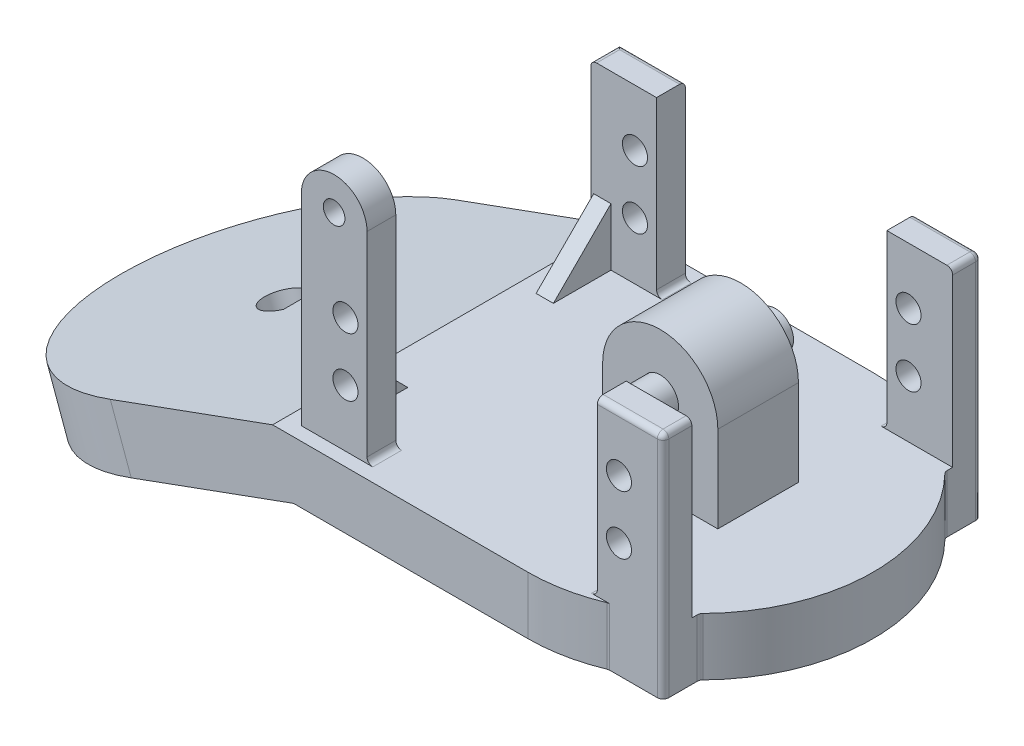
from build123d import *

# Parameters (mm, degrees)
BOSS_EXTRU_3_DEPTH       = 5
ESQUISSE7_R              = 3.175
BOSS_EXTRU_5_DEPTH       = 7
ESQUISSE13_R             = 2.18
BOSS_EXTRU_8_DEPTH       = 5
ENL_V_MAT_EXTRU_8_REACH  = 100.981
ESQUISSE47_W             = 40
ESQUISSE47_H             = 5
ESQUISSE33_W             = 9.466792894
ESQUISSE33_H             = 55.28
BOSS_EXTRU_10_DEPTH      = 10
ENL_V_MAT_EXTRU_6_DEPTH  = 65
ESQUISSE35_R             = 30
BOSS_EXTRU_11_DEPTH      = 5.32
BOSS_EXTRU_12_DEPTH      = 30
ENL_V_MAT_EXTRU_7_DEPTH  = 60
BOSS_EXTRU_13_DEPTH      = 5
NERVURE4_REACH           = 90.538
ESQUISSE45_WALL_W        = 193.218913386
ESQUISSE45_WALL_H        = 3
CONG_1_R                 = 1
CONG_2_R                 = 1
BOSS_EXTRU_14_DEPTH      = 13
BOSS_EXTRU_14_DEPTH_BACK = 13
ESQUISSE48_R             = 3.15


with BuildPart() as part:
    # Esquisse5 → Boss.-Extru.3 (new, symmetric)
    with BuildSketch(Plane(origin=(0, 0, 0), x_dir=(1, 0, 0), z_dir=(0, 1, 0))):
        with BuildLine():
            Line((42.5, -30), (-42.5, -30))
            ThreePointArc((-42.5, -30), (-72.5, 0), (-42.5, 30))
            Line((-42.5, 30), (42.5, 30))
            ThreePointArc((42.5, 30), (72.5, 0), (42.5, -30))
        make_face()
    extrude(amount=BOSS_EXTRU_3_DEPTH, both=True)

    # Esquisse7 → Boss.-Extru.5 (add, symmetric)
    with BuildSketch(Plane.XY):
        with BuildLine():
            Line((32.5, 5), (52.5, 5))
            Line((52.5, 5), (52.5, 20))
            ThreePointArc((52.5, 20), (42.5, 30), (32.5, 20))
            Line((32.5, 20), (32.5, 5))
        make_face()
        with Locations((42.5, 20)):
            Circle(ESQUISSE7_R, mode=Mode.SUBTRACT)
    extrude(amount=BOSS_EXTRU_5_DEPTH, both=True)

    # Esquisse13 → Boss.-Extru.8 (add)
    with BuildSketch(Plane.XY.offset(22.64)):
        Polygon((0.8, 5), (5.8, 5), (12.215, 5), (12.215, 29.91), (52.215, 29.91), (52.215, 5), (58.63, 5), (63.63, 5), (63.63, 34.91), (0.8, 34.91), align=None)
        with Locations((8.47, 14.92)):
            Circle(ESQUISSE13_R, mode=Mode.SUBTRACT)
        with Locations((55.97, 14.92)):
            Circle(ESQUISSE13_R, mode=Mode.SUBTRACT)
        with Locations((8.47, 25.08)):
            Circle(ESQUISSE13_R, mode=Mode.SUBTRACT)
        with Locations((55.97, 25.08)):
            Circle(ESQUISSE13_R, mode=Mode.SUBTRACT)
    boss_extru_8 = extrude(amount=BOSS_EXTRU_8_DEPTH)

    # Esquisse47 → Enlèv. mat.-Extru.8 (cut, up to next)
    with BuildSketch(Plane.XY.offset(27.64), mode=Mode.PRIVATE) as enl_v_mat_extru_8_sk1:
        with Locations((32.215, 32.41)):
            Rectangle(ESQUISSE47_W, ESQUISSE47_H)
    enl_v_mat_extru_8_tool1 = extrude(enl_v_mat_extru_8_sk1.sketch, amount=-ENL_V_MAT_EXTRU_8_REACH, mode=Mode.PRIVATE) & part.part
    enl_v_mat_extru_8 = enl_v_mat_extru_8_tool1.solids().sort_by_distance((32.215, 32.41, 27.64))[0]
    add(enl_v_mat_extru_8, mode=Mode.SUBTRACT)

    # Symétrie2: Boss.-Extru.8, Enlèv. mat.-Extru.8 across plane
    add(boss_extru_8.mirror(Plane.XY))
    add(enl_v_mat_extru_8.mirror(Plane.XY), mode=Mode.SUBTRACT)

    # Esquisse33 → Boss.-Extru.10 (add)
    with BuildSketch(Plane.XZ.offset(-5)):
        with Locations((58.896603553, 0)):
            Rectangle(ESQUISSE33_W, ESQUISSE33_H)
    extrude(amount=BOSS_EXTRU_10_DEPTH)

    # Esquisse36 → Enlèv. mat.-Extru.6 (cut, symmetric)
    with BuildSketch(Plane.XY):
        Polygon((0, 0), (9.099255857, -25), (-112.5, -25), (-112.5, 35), (-12.738958199, 35), align=None)
    extrude(amount=ENL_V_MAT_EXTRU_6_DEPTH, both=True, mode=Mode.SUBTRACT)



with BuildPart() as body_2:
    # Esquisse35 → Boss.-Extru.11 (new, symmetric)
    with BuildSketch(Plane(origin=(0, 0, 0), x_dir=(0, 0, -1), z_dir=(-0.34202014332566977, 0.939692620785908, 0))):
        with Locations(Location((0, 30, 0), (0, 0, 90))):
            Circle(ESQUISSE35_R)
    extrude(amount=BOSS_EXTRU_11_DEPTH, both=True)


with BuildPart() as part_1:
    add(part.part)

    add(body_2.part)  # Boss.-Extru.12 merges body 2
    # Esquisse40 → Boss.-Extru.12 (add, symmetric)
    with BuildSketch(Plane.XY):
        Polygon((-26.371231461, -15.259769042), (-30.010325786, -5.261439557), (-1.819547162, 4.999164743), (1.819547162, -4.999164743), align=None)
    extrude(amount=BOSS_EXTRU_12_DEPTH, both=True)

    # Esquisse41 → Enlèv. mat.-Extru.7 (cut)
    with BuildSketch(Plane(origin=(-1.819547162, 4.999164743, 0), x_dir=(0.939692620785908, 0.3420201433256698, 0), z_dir=(-0.3420201433256698, 0.9396926207859081, 0))):
        with BuildLine():
            Line((-27.46, -2.260176984), (-27.46, 2.260176984))
            ThreePointArc((-27.46, 2.260176984), (-33.4, 0), (-27.46, -2.260176984))
        make_face()
    extrude(amount=-ENL_V_MAT_EXTRU_7_DEPTH, mode=Mode.SUBTRACT)

    # Esquisse42 → Boss.-Extru.13 (add)
    with BuildSketch(Plane.XY.offset(27.64)):
        with BuildLine():
            Line((0.8, 39.91), (0.8, 34.91))
            Line((0.8, 34.91), (12.215, 34.91))
            Line((12.215, 34.91), (12.215, 39.91))
            Line((12.215, 39.91), (8.3825, 39.91))
            ThreePointArc((8.3825, 39.91), (6.5075, 38.035), (4.6325, 39.91))
            Line((4.6325, 39.91), (0.8, 39.91))
        make_face()
        with BuildLine():
            ThreePointArc((12.215, 39.91), (6.5075, 45.6175), (0.8, 39.91))
            Line((0.8, 39.91), (4.6325, 39.91))
            ThreePointArc((4.6325, 39.91), (6.5075, 41.785), (8.3825, 39.91))
            Line((8.3825, 39.91), (12.215, 39.91))
        make_face()
    extrude(amount=-BOSS_EXTRU_13_DEPTH)

    # Esquisse45 wall → Nervure4 (add, up to next)
    with BuildSketch(Plane(origin=(2.8, 9.999582371, 17.640000004), x_dir=(0, -0.707106781505, -0.707106780868), z_dir=(0, -0.707106780868, 0.707106781505)), mode=Mode.PRIVATE) as nervure4_sk1:
        Rectangle(ESQUISSE45_WALL_W, ESQUISSE45_WALL_H)
    nervure4_tool1 = extrude(nervure4_sk1.sketch, amount=NERVURE4_REACH, mode=Mode.PRIVATE) - part_1.part
    nervure4 = nervure4_tool1.solids().sort_by_distance((2.8, 9.999582371, 17.640000004))[0]
    add(nervure4)

    # Congé1
    cong_1_edges = [part_1.edges().sort_by_distance(p)[0] for p in [
        (54.163207106, 0, 27.64),
        (63.63, 14.955, -27.64),
        (54.163207106, 0, -27.64),
        (63.63, 14.955, 27.64),
        (63.63, 0, 21.296081799),
        (63.63, 0, -21.296081799),
    ]]
    fillet(cong_1_edges, radius=CONG_1_R)

    # Symétrie3: Nervure4 across plane
    add(nervure4.mirror(Plane.XY))

    # Congé2
    cong_2_edges = [part_1.edges().sort_by_distance(p)[0] for p in [
        (63.63, 34.91, 24.64),
        (63.337106781, 34.91, 27.347106781),
        (63.63, 34.91, -24.64),
        (63.337106781, 34.91, -27.347106781),
        (0.8, 34.91, -25.14),
        (57.4225, 34.91, -27.64),
        (6.5075, 34.91, -27.64),
        (52.215, 5, 25.14),
        (12.215, 5, -25.14),
        (57.4225, 34.91, 27.64),
        (12.215, 5, 25.14),
        (52.215, 5, -25.14),
    ]]
    fillet(cong_2_edges, radius=CONG_2_R)


with BuildPart() as body_2_2:
    # Esquisse48 → Boss.-Extru.14 (new, two sides: drawn at the far end of the back side and taken through both)
    with BuildSketch(Plane.XY.offset(-BOSS_EXTRU_14_DEPTH_BACK)):
        with Locations((42.5, 20)):
            Circle(ESQUISSE48_R)
    extrude(amount=BOSS_EXTRU_14_DEPTH + BOSS_EXTRU_14_DEPTH_BACK)


solid = Compound([part_1.part, body_2_2.part])
